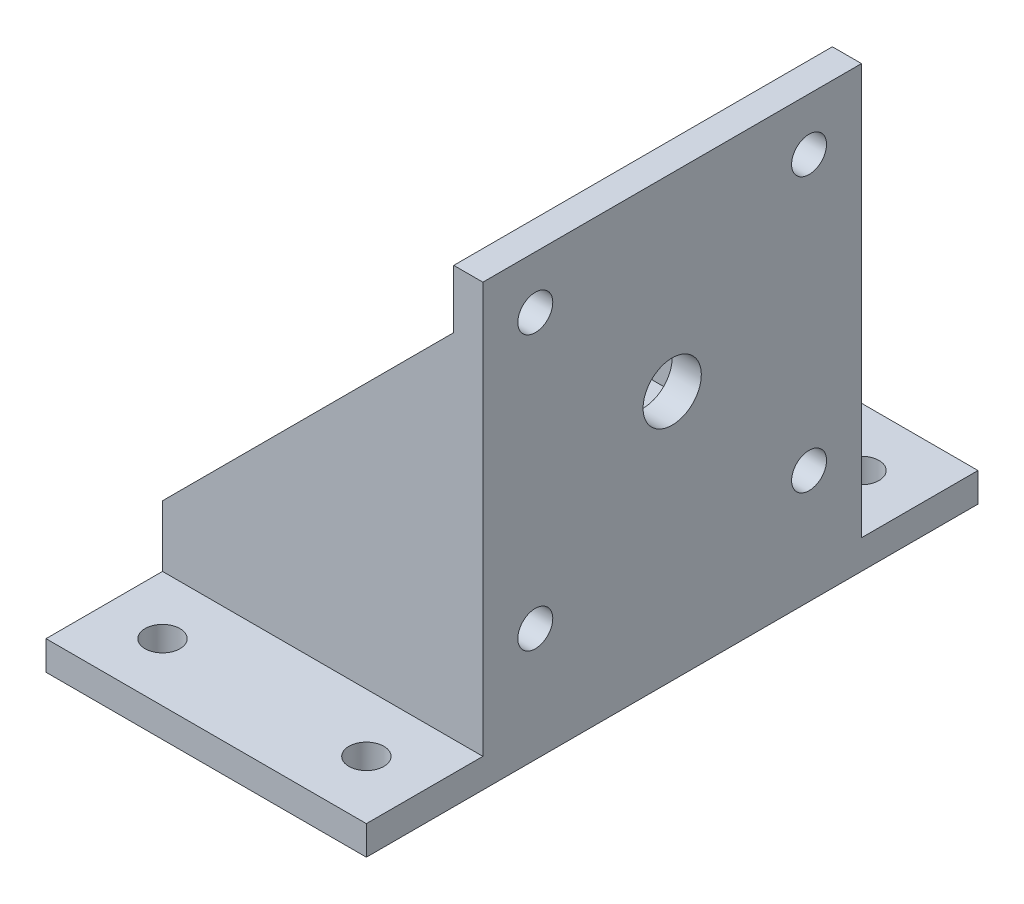
from build123d import *

# Parameters (mm, degrees)
BOSS_EXTRUDE1_DEPTH = 65
BOSS_EXTRUDE2_DEPTH = 5
BOSS_EXTRUDE3_DEPTH = 5
SKETCH4_R           = 5
SKETCH4_R_2         = 3
CUT_EXTRUDE1_DEPTH  = 102.612007165
SKETCH5_W           = 55
SKETCH5_H           = 20
BOSS_EXTRUDE4_DEPTH = 5
SKETCH6_R           = 3
CUT_EXTRUDE2_DEPTH  = 5


with BuildPart() as part:
    # Sketch1 → Boss-Extrude1 (new body)
    with BuildSketch(Plane.XY):
        Polygon((0, 0), (0, 60), (5, 60), (5, -15.5), (-50, -15.5), (-50, 0), align=None)
    extrude(amount=BOSS_EXTRUDE1_DEPTH)

    # Sketch2 → Boss-Extrude2 (add)
    with BuildSketch(Plane(origin=(0, 0, 0), x_dir=(-1, 0, 0), z_dir=(0, 0, -1))):
        Polygon((0, 0), (50, 0), (0, 50), align=None)
    extrude(amount=-BOSS_EXTRUDE2_DEPTH)

    # Sketch3 → Boss-Extrude3 (add)
    with BuildSketch(Plane.XY.offset(65)):
        Polygon((-50, 0), (0, 0), (0, 50), align=None)
    extrude(amount=-BOSS_EXTRUDE3_DEPTH)

    # Sketch4 → Cut-Extrude1 (cut, through all)
    with BuildSketch(Plane.ZY):
        with Locations(Location((32.5, 27.5, 0), (0, 0, 270))):
            Circle(SKETCH4_R)
        with Locations(Location((9, 51, 0), (0, 0, 270))):
            Circle(SKETCH4_R_2)
        with Locations(Location((56, 51, 0), (0, 0, 270))):
            Circle(SKETCH4_R_2)
        with Locations(Location((56, 4, 0), (0, 0, 270))):
            Circle(SKETCH4_R_2)
        with Locations(Location((9, 4, 0), (0, 0, 270))):
            Circle(SKETCH4_R_2)
    extrude(amount=-CUT_EXTRUDE1_DEPTH, mode=Mode.SUBTRACT)

    # Sketch5 → Boss-Extrude4 (add)
    with BuildSketch(Plane.XZ.offset(15.5)):
        with Locations((-22.5, -10)):
            Rectangle(SKETCH5_W, SKETCH5_H)
        with Locations((-22.5, 75)):
            Rectangle(SKETCH5_W, SKETCH5_H)
    extrude(amount=-BOSS_EXTRUDE4_DEPTH)

    # Sketch6 → Cut-Extrude2 (cut)
    with BuildSketch(Plane(origin=(0, -10.5, 0), x_dir=(1, 0, 0), z_dir=(0, 1, 0))):
        with Locations(Location((-5, 10, 0), (0, 0, 180))):
            Circle(SKETCH6_R)
        with Locations(Location((-40, 10, 0), (0, 0, 180))):
            Circle(SKETCH6_R)
        with Locations((-5, -75)):
            Circle(SKETCH6_R)
        with Locations((-40, -75)):
            Circle(SKETCH6_R)
    extrude(amount=-CUT_EXTRUDE2_DEPTH, mode=Mode.SUBTRACT)


solid = part.part
